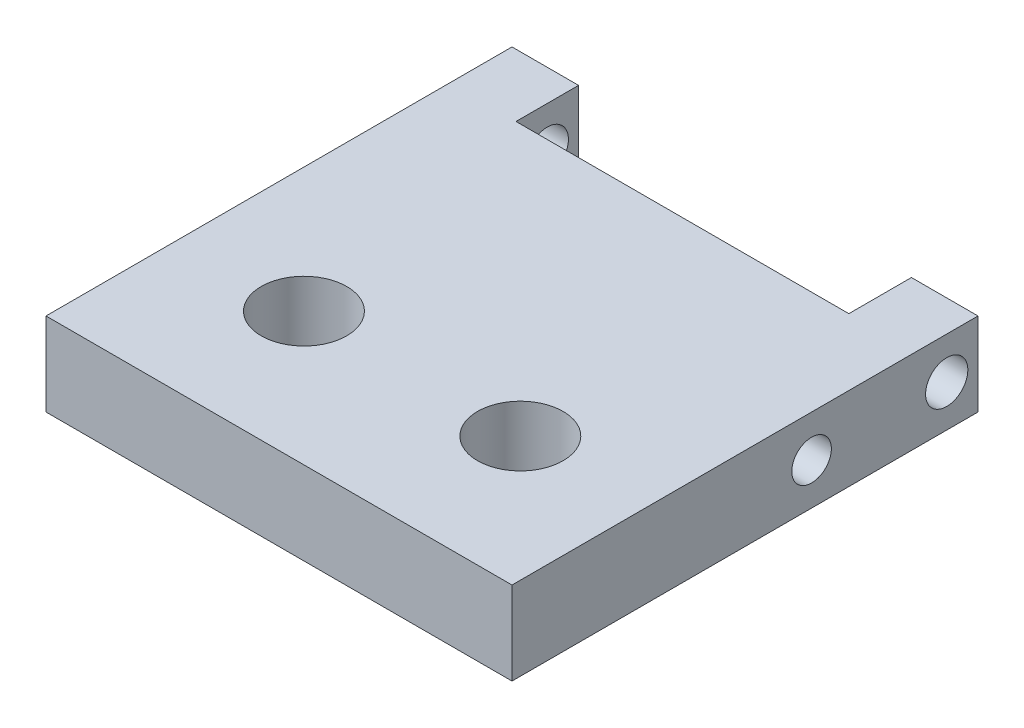
from build123d import *

# Parameters (mm, degrees)
SKETCH1_W             = 17.78
SKETCH1_H             = 17.78
BOSS_EXTRUDE1_DEPTH   = 3.175
SKETCH2_W             = 12.7
SKETCH2_H             = 4.7752
CUT_EXTRUDE1_DEPTH    = 13.967066939
F_4_CLEARANCE_HOLE1_D = 3.2639
F_0_CLEARANCE_HOLE1_D = 1.6129
F_1_72_TAPPED_HOLE1_D = 1.5113


with BuildPart() as part:
    # Sketch1 → Boss-Extrude1 (new body)
    with BuildSketch(Plane(origin=(0, 0, 0), x_dir=(1, 0, 0), z_dir=(0, 1, 0))):
        Rectangle(SKETCH1_W, SKETCH1_H)
    extrude(amount=BOSS_EXTRUDE1_DEPTH)

    # Sketch2 → Cut-Extrude1 (cut, through all)
    with BuildSketch(Plane(origin=(0, 3.175, 0), x_dir=(1, 0, 0), z_dir=(0, 1, 0))):
        with Locations((0, 8.89)):
            Rectangle(SKETCH2_W, SKETCH2_H)
    extrude(amount=-CUT_EXTRUDE1_DEPTH, mode=Mode.SUBTRACT)

    # #4 Clearance Hole1 (through all)
    with Locations(Plane(origin=(0, 3.175, 0), x_dir=(1, 0, 0), z_dir=(0, 1, 0))):
        with Locations((4.1275, -3.81), (-4.1275, -3.81)):
            Hole(F_4_CLEARANCE_HOLE1_D / 2)

    # #0 Clearance Hole1 (through all)
    with Locations(Plane(origin=(8.89, 0, 0), x_dir=(0, 0, -1), z_dir=(1, 0, 0))):
        with Locations((7.6962, 1.5875)):
            Hole(F_0_CLEARANCE_HOLE1_D / 2)

    # #1-72 Tapped Hole1 (through all)
    with Locations(Plane(origin=(8.89, 0, 0), x_dir=(0, 0, -1), z_dir=(1, 0, 0))):
        with Locations((2.54, 1.5875)):
            Hole(F_1_72_TAPPED_HOLE1_D / 2)


solid = part.part
